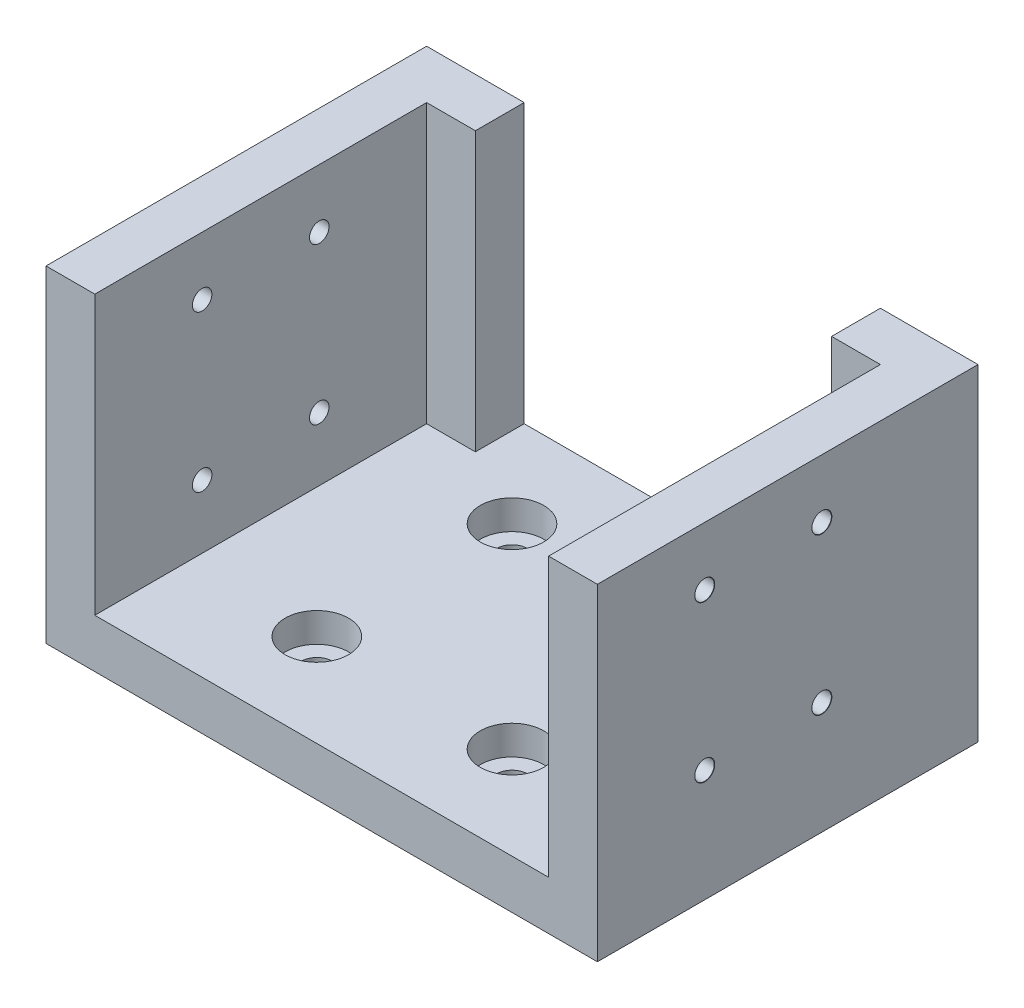
from build123d import *

# Parameters (mm, degrees)
SKETCH9_W                                       = 56.5
SKETCH9_H                                       = 39
BOSS_EXTRUDE7_DEPTH                             = 33.5
CUT_EXTRUDE3_DEPTH                              = 28.5
SKETCH12_W                                      = 36.5
SKETCH12_H                                      = 28.5
CUT_EXTRUDE4_DEPTH                              = 56.464515683
CBORE_FOR_M3_SOCKET_HEAD_CAP_SCREW3_D           = 3.2
CBORE_FOR_M3_SOCKET_HEAD_CAP_SCREW3_CBORE_D     = 6.5
CBORE_FOR_M3_SOCKET_HEAD_CAP_SCREW3_CBORE_DEPTH = 3
F_2_0MM_DOWEL_HOLE1_D                           = 2
F_2_0MM_DOWEL_HOLE1_CSINK_D                     = 2.05
F_2_0MM_DOWEL_HOLE1_CSINK_ANGLE                 = 90


with BuildPart() as part:
    # Sketch9 → Boss-Extrude7 (new body)
    with BuildSketch(Plane(origin=(0, 0, 0), x_dir=(1, 0, 0), z_dir=(0, 1, 0))):
        Rectangle(SKETCH9_W, SKETCH9_H)
    extrude(amount=BOSS_EXTRUDE7_DEPTH)

    # Sketch11 → Cut-Extrude3 (cut)
    with BuildSketch(Plane(origin=(0, 33.5, 0), x_dir=(1, 0, 0), z_dir=(0, 1, 0))):
        Polygon((-23.25, -14.5), (-23.25, -19.5), (23.25, -19.5), (23.25, -14.5), (23.25, 14.5), (-23.25, 14.5), align=None)
    extrude(amount=-CUT_EXTRUDE3_DEPTH, mode=Mode.SUBTRACT)

    # Sketch12 → Cut-Extrude4 (cut, through all)
    with BuildSketch(Plane.XY.offset(-14.5)):
        with Locations((0, 19.25)):
            Rectangle(SKETCH12_W, SKETCH12_H)
    extrude(amount=-CUT_EXTRUDE4_DEPTH, mode=Mode.SUBTRACT)

    # CBORE for M3 Socket Head Cap Screw3 (through all)
    with Locations(Plane(origin=(10, 5, -10), x_dir=(0, 0, 1), z_dir=(0, 1, 0))):
        with Locations((0, 0), (20, 0), (20, -20), (0, -20)):
            CounterBoreHole(CBORE_FOR_M3_SOCKET_HEAD_CAP_SCREW3_D / 2, CBORE_FOR_M3_SOCKET_HEAD_CAP_SCREW3_CBORE_D / 2, CBORE_FOR_M3_SOCKET_HEAD_CAP_SCREW3_CBORE_DEPTH)

    # Ø2.0mm Dowel Hole1 (through all)
    with Locations(Plane(origin=(28.25, 0, 0), x_dir=(0, 0, -1), z_dir=(1, 0, 0))):
        with Locations((-8.5, 27.5), (-8.5, 11.5), (3.5, 11.5), (3.5, 27.5)):
            CounterSinkHole(F_2_0MM_DOWEL_HOLE1_D / 2, F_2_0MM_DOWEL_HOLE1_CSINK_D / 2, counter_sink_angle=F_2_0MM_DOWEL_HOLE1_CSINK_ANGLE)


solid = part.part
